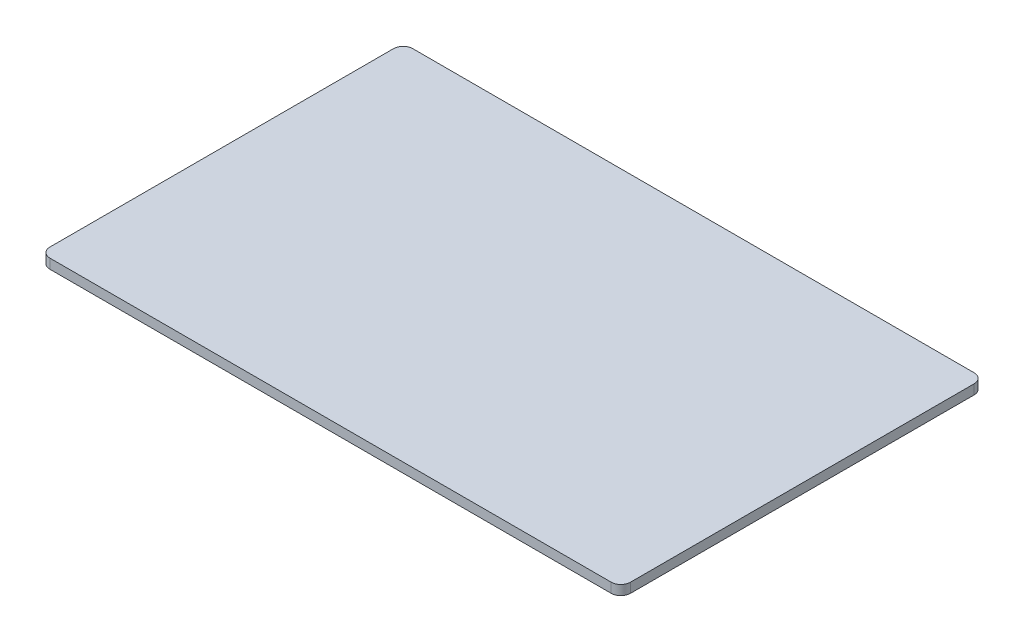
from build123d import *

# Parameters (mm, degrees)
SKETCH_1_W      = 120
SKETCH_1_H      = 75
EXTRUDE_1_DEPTH = 2
FILLET_1_R      = 2


with BuildPart() as part:
    # 草图1 → 凸台-拉伸1 (new body)
    with BuildSketch(Plane(origin=(0, 0, 0), x_dir=(1, 0, 0), z_dir=(0, 1, 0))):
        with Locations((0.995024876, -1.281094527)):
            Rectangle(SKETCH_1_W, SKETCH_1_H)
    extrude(amount=EXTRUDE_1_DEPTH)

    # 圆角1
    fillet_1_edges = [part.edges().sort_by_distance(p)[0] for p in [
        (-59.004975124, 1, -36.218905473),
        (60.995024876, 1, -36.218905473),
        (60.995024876, 1, 38.781094527),
        (-59.004975124, 1, 38.781094527),
    ]]
    fillet(fillet_1_edges, radius=FILLET_1_R)


solid = part.part
